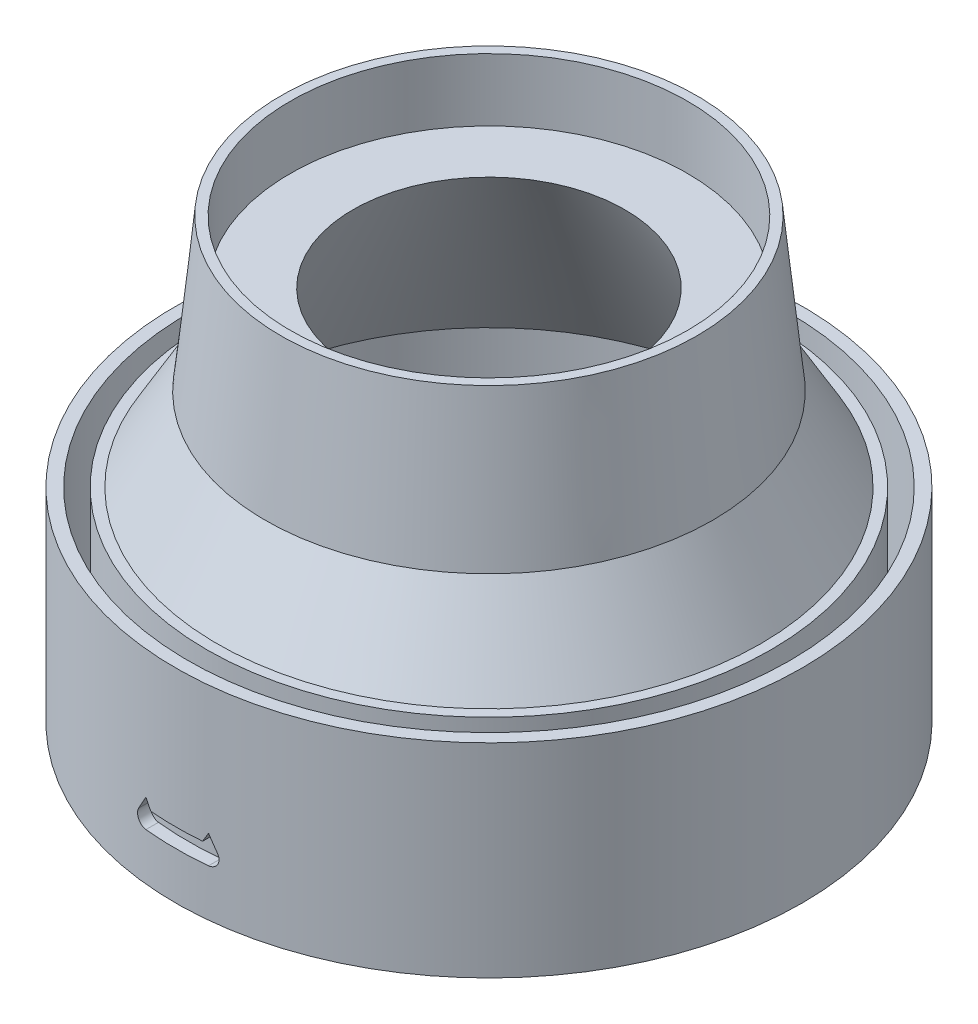
from build123d import *

# Parameters (mm, degrees)
CUT_EXTRUDE_1798_DEPTH   = 103.8
CUT_EXTRUDE_3_REACH      = 141.642
CUT_EXTRUDE_3_END_RADIUS = 48


with BuildPart() as part:
    # Эскиз1 → Повернуть1 (revolve)
    with BuildSketch(Plane.XY):
        Polygon((21.7, 60), (31.7, 60), (31.7, 70), (33.2, 70), (35.7, 45.751288694), (43.350635095, 32.5), (45, 32.5), (45, 2.5), (48, 2.5), (48, 32.5), (50, 32.5), (50, 0), (42, 0), (42, 24.839368606), align=None)
    revolve(axis=Axis((0, 4, 0), (0, -1, 0)))

    # Эскиз3 → Cut-Extrude 1798 (cut, symmetric)
    with BuildSketch(Plane.XY):
        with BuildLine():
            Line((3.700961894, 9.781798364), (5, 12.031798364))
            Line((5, 12.031798364), (6.299038106, 9.781798364))
            ThreePointArc((6.299038106, 9.781798364), (5, 7.531798364), (3.700961894, 9.781798364))
        make_face()
        with BuildLine():
            Line((-3.700961894, 9.781798364), (-5, 12.031798364))
            Line((-5, 12.031798364), (-6.299038106, 9.781798364))
            ThreePointArc((-6.299038106, 9.781798364), (-5, 7.531798364), (-3.700961894, 9.781798364))
        make_face()
    extrude(amount=CUT_EXTRUDE_1798_DEPTH, both=True, mode=Mode.SUBTRACT)

    # Вырез-Вытянуть3: up to this cylinder (the profile starts outside it)
    cut_extrude_3_end = Plane(origin=(0, 9.031798, 0), z_dir=(0, -1, 0)) * Cylinder(CUT_EXTRUDE_3_END_RADIUS, 380.284, mode=Mode.PRIVATE)
    # Эскиз4 → Вырез-Вытянуть3 (cut, up to the surface)
    with BuildSketch(Plane.XY.offset(-60), mode=Mode.PRIVATE) as cut_extrude_3_sk1:
        with BuildLine():
            Line((-5, 10.531798364), (5, 10.531798364))
            ThreePointArc((5, 10.531798364), (6.5, 9.031798364), (5, 7.531798364))
            Line((5, 7.531798364), (-5, 7.531798364))
            ThreePointArc((-5, 7.531798364), (-6.5, 9.031798364), (-5, 10.531798364))
        make_face()
    cut_extrude_3_tool1 = extrude(cut_extrude_3_sk1.sketch, amount=CUT_EXTRUDE_3_REACH, mode=Mode.PRIVATE) - cut_extrude_3_end
    cut_extrude_3 = cut_extrude_3_tool1.solids().sort_by_distance((0, 9.031798, -60))[0]
    add(cut_extrude_3, mode=Mode.SUBTRACT)

    # Зеркальное отражение1: Вырез-Вытянуть3 across plane
    add(cut_extrude_3.mirror(Plane.XY), mode=Mode.SUBTRACT)


solid = part.part
